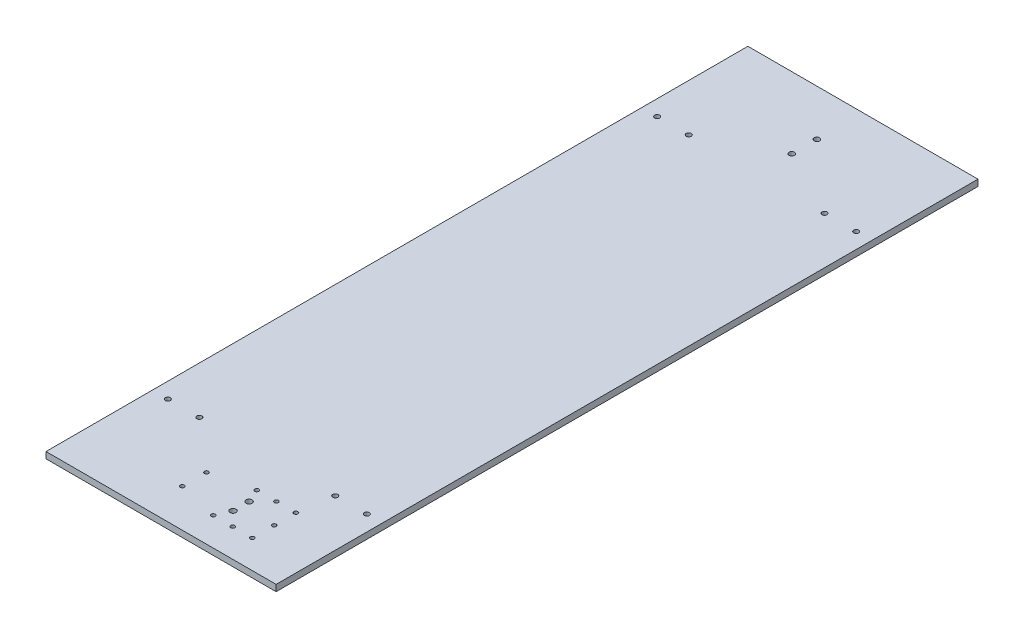
from build123d import *

# Parameters (mm, degrees)
ESQUISSE1_W             = 229.5
ESQUISSE1_H             = 700
BOSS_EXTRU_1_DEPTH      = 6.35
ESQUISSE2_R             = 2
ESQUISSE2_R_2           = 3
ESQUISSE2_R_3           = 2.5
ENL_V_MAT_EXTRU_1_DEPTH = 369.385511387
ESQUISSE3_R             = 2.75
ENL_V_MAT_EXTRU_2_DEPTH = 369.385511387


with BuildPart() as part:
    # Esquisse1 → Boss.-Extru.1 (new body)
    with BuildSketch(Plane(origin=(0, 0, 0), x_dir=(1, 0, 0), z_dir=(0, 1, 0))):
        Rectangle(ESQUISSE1_W, ESQUISSE1_H)
    extrude(amount=BOSS_EXTRU_1_DEPTH)

    # Esquisse2 → Enlèv. mat.-Extru.1 (cut, through all)
    with BuildSketch(Plane.XZ):
        with Locations(Location((-16.75, 312, 0), (0, 0, 270))):
            Circle(ESQUISSE2_R)
        with Locations(Location((-16.75, 288, 0), (0, 0, 270))):
            Circle(ESQUISSE2_R)
        with Locations(Location((23.75, 321.75, 0), (0, 0, 270))):
            Circle(ESQUISSE2_R)
        with Locations(Location((23.75, 278.25, 0), (0, 0, 270))):
            Circle(ESQUISSE2_R)
        with Locations(Location((43.25, 278.25, 0), (0, 0, 270))):
            Circle(ESQUISSE2_R)
        with Locations(Location((43.25, 321.75, 0), (0, 0, 270))):
            Circle(ESQUISSE2_R)
        with Locations(Location((62.75, 321.75, 0), (0, 0, 270))):
            Circle(ESQUISSE2_R)
        with Locations(Location((62.75, 300, 0), (0, 0, 270))):
            Circle(ESQUISSE2_R)
        with Locations(Location((62.75, 278.25, 0), (0, 0, 270))):
            Circle(ESQUISSE2_R)
        with Locations(Location((29.75, 292, 0), (0, 0, 270))):
            Circle(ESQUISSE2_R_2)
        with Locations(Location((29.75, 308, 0), (0, 0, 270))):
            Circle(ESQUISSE2_R_2)
        with Locations(Location((67.75, 244, 0), (0, 0, 270))):
            Circle(ESQUISSE2_R_3)
        with Locations(Location((99.25, 244, 0), (0, 0, 270))):
            Circle(ESQUISSE2_R_3)
        with Locations(Location((67.75, -244, 0), (0, 0, 90))):
            Circle(ESQUISSE2_R_3)
        with Locations(Location((99.25, -244, 0), (0, 0, 90))):
            Circle(ESQUISSE2_R_3)
        with Locations(Location((-99.25, -244, 0), (0, 0, 270))):
            Circle(ESQUISSE2_R_3)
        with Locations(Location((-67.75, -244, 0), (0, 0, 270))):
            Circle(ESQUISSE2_R_3)
        with Locations(Location((-99.25, 244, 0), (0, 0, 90))):
            Circle(ESQUISSE2_R_3)
        with Locations(Location((-67.75, 244, 0), (0, 0, 90))):
            Circle(ESQUISSE2_R_3)
    extrude(amount=-ENL_V_MAT_EXTRU_1_DEPTH, mode=Mode.SUBTRACT)

    # Esquisse3 → Enlèv. mat.-Extru.2 (cut, through all)
    with BuildSketch(Plane(origin=(0, 6.35, 0), x_dir=(1, 0, 0), z_dir=(0, 1, 0))):
        with Locations(Location((0, 279, 0), (0, 0, 270))):
            Circle(ESQUISSE3_R)
        with Locations(Location((0, 304, 0), (0, 0, 270))):
            Circle(ESQUISSE3_R)
    extrude(amount=-ENL_V_MAT_EXTRU_2_DEPTH, mode=Mode.SUBTRACT)


solid = part.part
